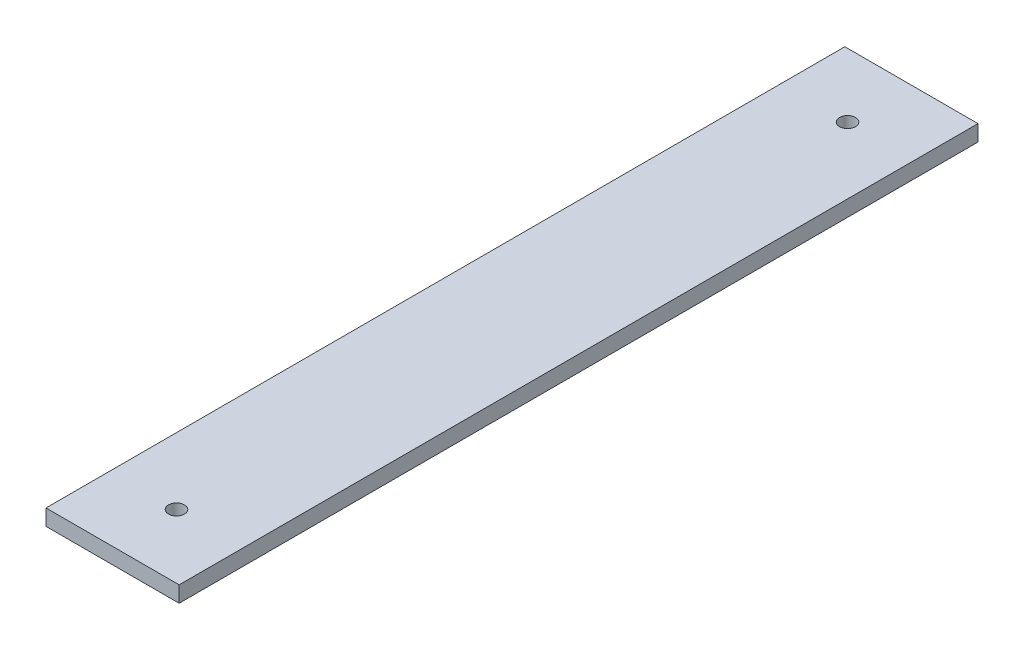
from build123d import *

# Parameters (mm, degrees)
SKETCH2_W           = 25
SKETCH2_H           = 150
BOSS_EXTRUDE1_DEPTH = 3
SKETCH3_R           = 1.5
CUT_EXTRUDE1_DEPTH  = 11


with BuildPart() as part:
    # Sketch2 → Boss-Extrude1 (new body)
    with BuildSketch(Plane(origin=(0, 0, 0), x_dir=(1, 0, 0), z_dir=(0, 1, 0))):
        Rectangle(SKETCH2_W, SKETCH2_H)
    extrude(amount=BOSS_EXTRUDE1_DEPTH)

    # Sketch3 → Cut-Extrude1 (cut)
    with BuildSketch(Plane(origin=(0, 3, 0), x_dir=(1, 0, 0), z_dir=(0, 1, 0))):
        with Locations(Location((0, 63, 0), (0, 0, 270))):
            Circle(SKETCH3_R)
    cut_extrude1 = extrude(amount=-CUT_EXTRUDE1_DEPTH, mode=Mode.SUBTRACT)

    # Mirror1: Cut-Extrude1 across plane
    add(cut_extrude1.mirror(Plane.XY), mode=Mode.SUBTRACT)


solid = part.part
